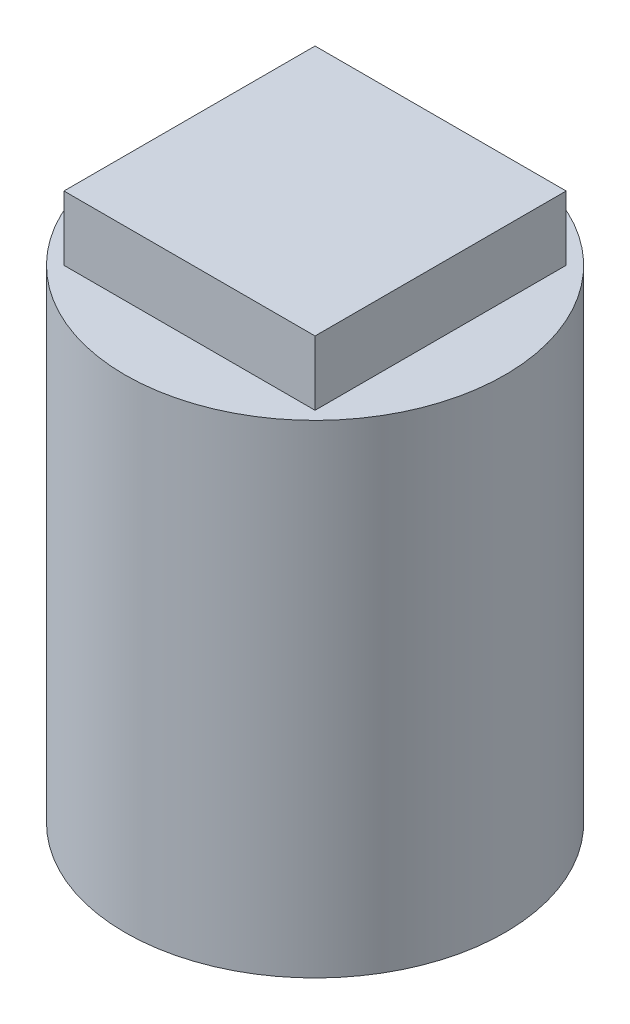
from build123d import *

# Parameters (mm, degrees)
SKETCH1_R           = 2.95
BOSS_EXTRUDE1_DEPTH = 7.5
SKETCH2_W           = 3.9
SKETCH2_H           = 3.9
BOSS_EXTRUDE3_DEPTH = 1


with BuildPart() as part:
    # Sketch1 → Boss-Extrude1 (new body)
    with BuildSketch(Plane(origin=(0, 0, 0), x_dir=(1, 0, 0), z_dir=(0, 1, 0))):
        with Locations(Location((0, 0, 0), (0, 0, 270))):
            Circle(SKETCH1_R)
    extrude(amount=BOSS_EXTRUDE1_DEPTH)

    # Sketch2 → Boss-Extrude3 (add)
    with BuildSketch(Plane(origin=(0, 7.5, 0), x_dir=(1, 0, 0), z_dir=(0, 1, 0))):
        Rectangle(SKETCH2_W, SKETCH2_H)
    extrude(amount=BOSS_EXTRUDE3_DEPTH)


solid = part.part
